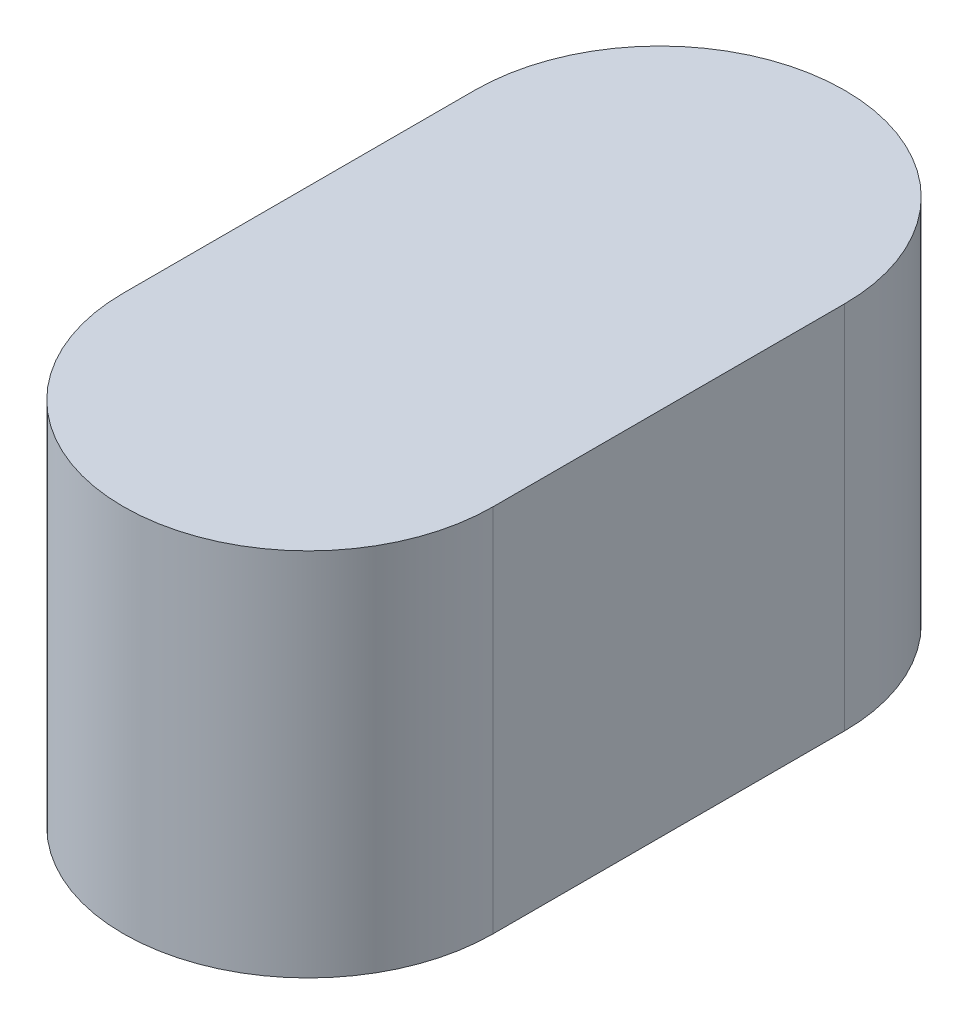
from build123d import *

# Parameters (mm, degrees)
BOSS_EXTRU_1_DEPTH = 4


with BuildPart() as part:
    # Esquisse1 → Boss.-Extru.1 (new body)
    with BuildSketch(Plane(origin=(0, 0, 0), x_dir=(1, 0, 0), z_dir=(0, 1, 0))):
        with BuildLine():
            Line((2, 1.9), (2, -1.9))
            ThreePointArc((2, -1.9), (0, -3.9), (-2, -1.9))
            Line((-2, -1.9), (-2, 1.9))
            ThreePointArc((-2, 1.9), (0, 3.9), (2, 1.9))
        make_face()
    extrude(amount=BOSS_EXTRU_1_DEPTH)


solid = part.part
